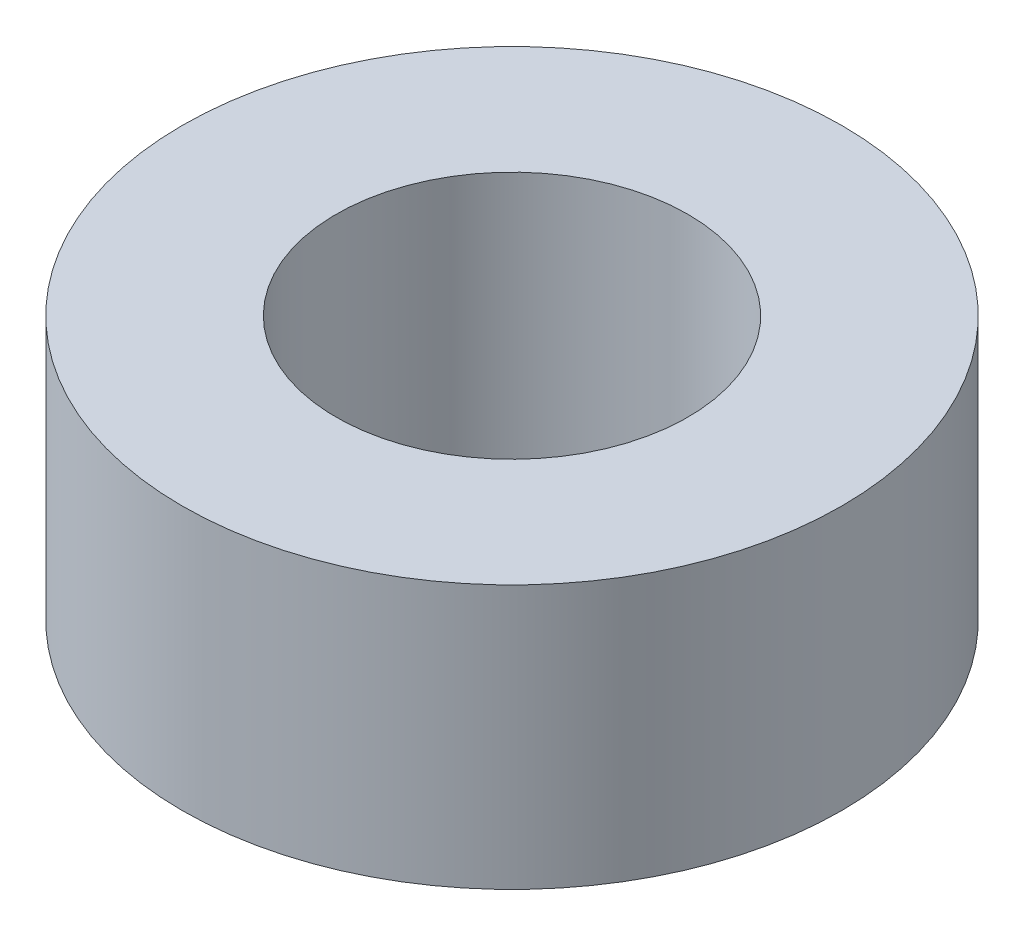
from build123d import *

# Parameters (mm, degrees)
SKETCH1_R           = 11.90625
SKETCH1_R_2         = 6.35
BOSS_EXTRUDE1_DEPTH = 9.525


with BuildPart() as part:
    # Sketch1 → Boss-Extrude1 (new body)
    with BuildSketch(Plane(origin=(0, 0, 0), x_dir=(1, 0, 0), z_dir=(0, 1, 0))):
        with Locations(Location((0, 0, 0), (0, 0, 90))):
            Circle(SKETCH1_R)
        with Locations(Location((0, 0, 0), (0, 0, 90))):
            Circle(SKETCH1_R_2, mode=Mode.SUBTRACT)
    extrude(amount=BOSS_EXTRUDE1_DEPTH)


solid = part.part
